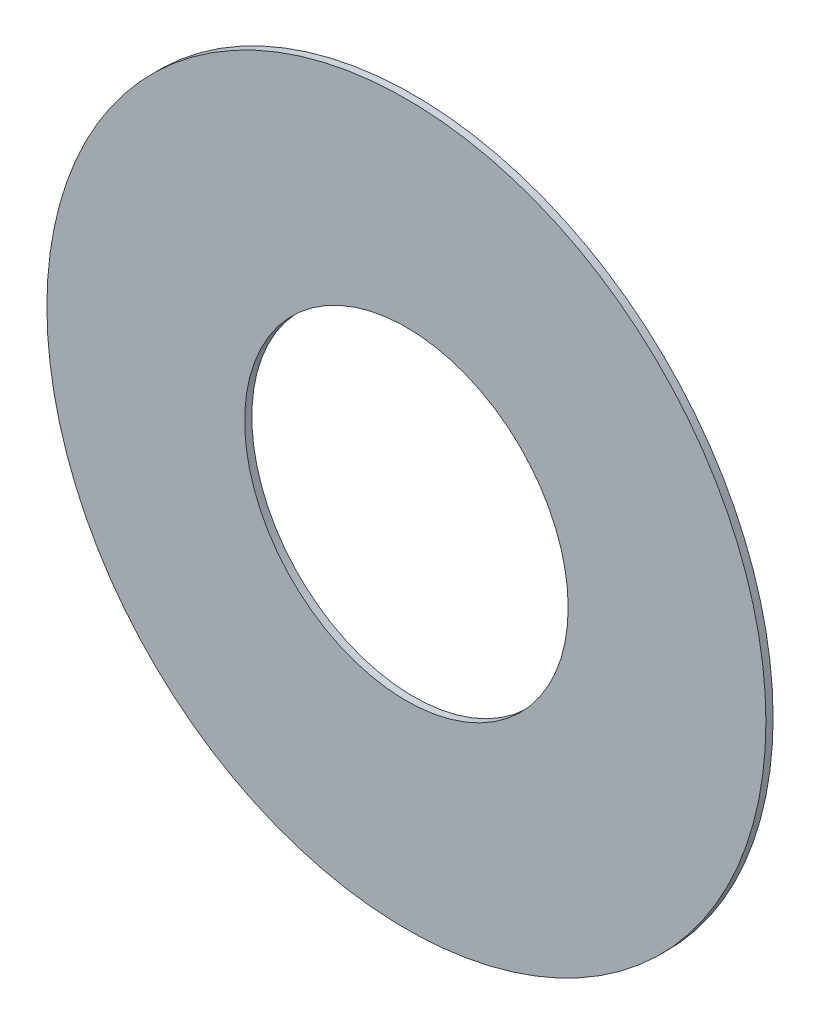
from build123d import *

# Parameters (mm, degrees)
ESQUISSE1_R             = 12
BOSS_EXTRU_1_DEPTH      = 0.24
ESQUISSE2_R             = 5.4
ENL_V_MAT_EXTRU_1_DEPTH = 44


with BuildPart() as part:
    # Esquisse1 → Boss.-Extru.1 (new body)
    with BuildSketch(Plane.XY):
        Circle(ESQUISSE1_R)
    extrude(amount=BOSS_EXTRU_1_DEPTH)

    # Esquisse2 → Enlèv. mat.-Extru.1 (cut)
    with BuildSketch(Plane.XY):
        Circle(ESQUISSE2_R)
    extrude(amount=ENL_V_MAT_EXTRU_1_DEPTH, mode=Mode.SUBTRACT)


solid = part.part
